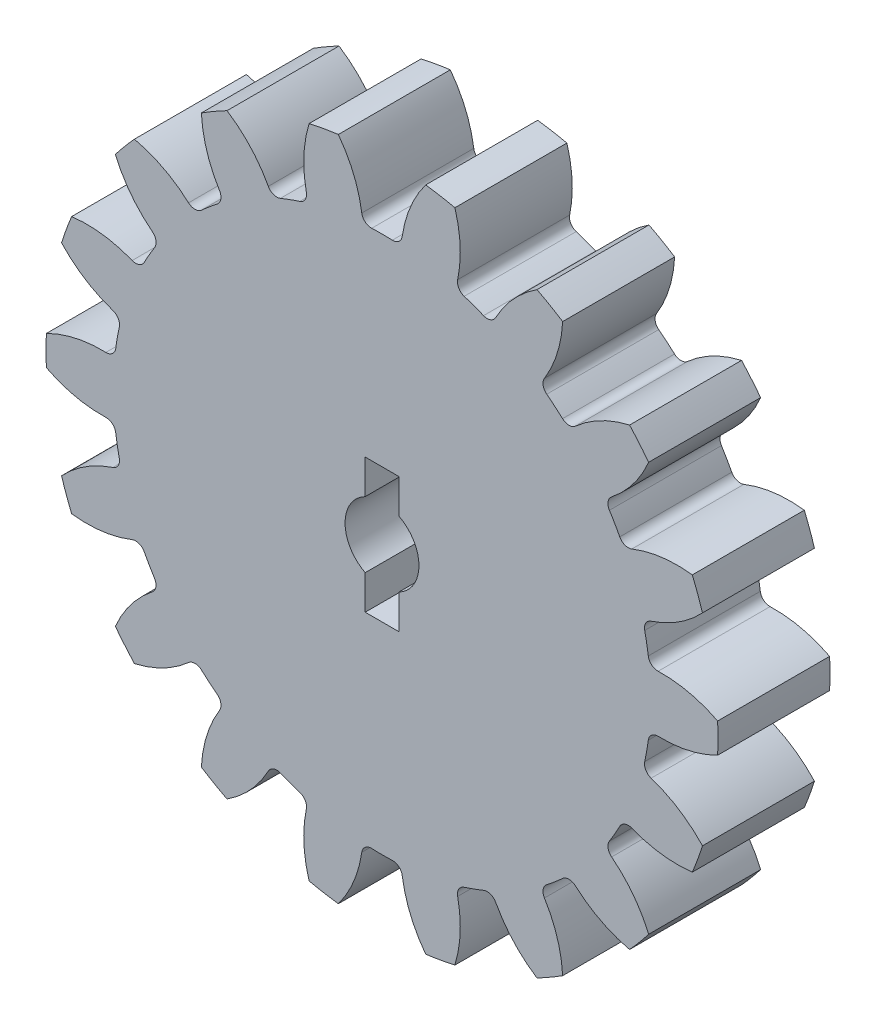
from build123d import *

# Parameters (mm, degrees)
SKETCH1_R                      = 15
BOSS_EXTRUDE1_DEPTH            = 2.5
CUT_EXTRUDE1_DEPTH             = 22.360009363
FILLET2_R                      = 0.43
CIRPATTERN1_COUNT              = 18
FILLET2_OF_CIRPATTERN1_R       = 0.43
THROUGH_CENTER_HOLE_DEPTH      = 22.27079237
THROUGH_CENTER_HOLE_DEPTH_BACK = 22.27079237


with BuildPart() as part:
    # Sketch1 → Boss-Extrude1 (new, symmetric)
    with BuildSketch(Plane.XY):
        Circle(SKETCH1_R)
    extrude(amount=BOSS_EXTRUDE1_DEPTH, both=True)

    # Sketch3 → Cut-Extrude1 (cut, symmetric)
    with BuildSketch(Plane.XY):
        with BuildLine():
            ThreePointArc((1.950230351, 14.872679704), (1.195470385, 13.499676366), (0.860599488, 11.969100573))
            ThreePointArc((0.860599488, 11.969100573), (0, 12), (-0.860599488, 11.969100573))
            ThreePointArc((-0.860599488, 11.969100573), (-1.195470385, 13.499676366), (-1.950230351, 14.872679704))
            ThreePointArc((-1.950230351, 14.872679704), (0, 15), (1.950230351, 14.872679704))
        make_face()
    cut_extrude1 = extrude(amount=CUT_EXTRUDE1_DEPTH, both=True, mode=Mode.SUBTRACT)

    # Fillet2
    fillet2_edges = [part.edges().sort_by_distance(p)[0] for p in [
        (-0.860599488, 11.969100573, 0),
        (0.860599488, 11.969100573, 0),
    ]]
    fillet(fillet2_edges, radius=FILLET2_R)

    # CirPattern1: Cut-Extrude1 ×18 about axis
    cirpattern1_axis = Axis((0, 0, 0), (0, 0, 1))
    for i in range(1, CIRPATTERN1_COUNT):
        add(cut_extrude1.rotate(cirpattern1_axis, i * 360 / CIRPATTERN1_COUNT), mode=Mode.SUBTRACT)

    # Fillet2 of CirPattern1
    fillet2_of_cirpattern1_edges = [part.edges().sort_by_distance(p)[0] for p in [
        (-4.902372482, 10.952933125, 0),
        (-3.284974505, 11.541617846, 0),
        (-8.352847003, 8.615680295, 0),
        (-7.034332092, 9.722045671, 0),
        (-10.7958449, 5.239249267, 0),
        (-9.935245413, 6.729851305, 0),
        (-11.936704573, 1.230887455, 0),
        (-11.637821508, 2.925937551, 0),
        (-11.637821508, -2.925937551, 0),
        (-11.936704573, -1.230887455, 0),
        (-9.935245413, -6.729851305, 0),
        (-10.7958449, -5.239249267, 0),
        (-7.034332092, -9.722045671, 0),
        (-8.352847003, -8.615680295, 0),
        (-3.284974505, -11.541617846, 0),
        (-4.902372482, -10.952933125, 0),
        (0.860599488, -11.969100573, 0),
        (-0.860599488, -11.969100573, 0),
        (4.902372482, -10.952933125, 0),
        (3.284974505, -11.541617846, 0),
        (8.352847003, -8.615680295, 0),
        (7.034332092, -9.722045671, 0),
        (10.7958449, -5.239249267, 0),
        (9.935245413, -6.729851305, 0),
        (11.936704573, -1.230887455, 0),
        (11.637821508, -2.925937551, 0),
        (11.637821508, 2.925937551, 0),
        (11.936704573, 1.230887455, 0),
        (9.935245413, 6.729851305, 0),
        (10.7958449, 5.239249267, 0),
        (7.034332092, 9.722045671, 0),
        (8.352847003, 8.615680295, 0),
        (3.284974505, 11.541617846, 0),
        (4.902372482, 10.952933125, 0),
    ]]
    fillet(fillet2_of_cirpattern1_edges, radius=FILLET2_OF_CIRPATTERN1_R)

    # Sketch4 → Through_Center_Hole (cut, two sides: drawn at the far end of the back side and taken through both)
    with BuildSketch(Plane.XY.offset(-THROUGH_CENTER_HOLE_DEPTH_BACK)):
        with BuildLine():
            Line((-0.75, 3), (0.75, 3))
            Line((0.75, 3), (0.75, 1.469693846))
            ThreePointArc((0.75, 1.469693846), (1.65, 0), (0.75, -1.469693846))
            Line((0.75, -1.469693846), (0.75, -3))
            Line((0.75, -3), (-0.75, -3))
            Line((-0.75, -3), (-0.75, -1.469693846))
            ThreePointArc((-0.75, -1.469693846), (-1.65, 0), (-0.75, 1.469693846))
            Line((-0.75, 1.469693846), (-0.75, 3))
        make_face()
    extrude(amount=THROUGH_CENTER_HOLE_DEPTH + THROUGH_CENTER_HOLE_DEPTH_BACK, mode=Mode.SUBTRACT)


solid = part.part
